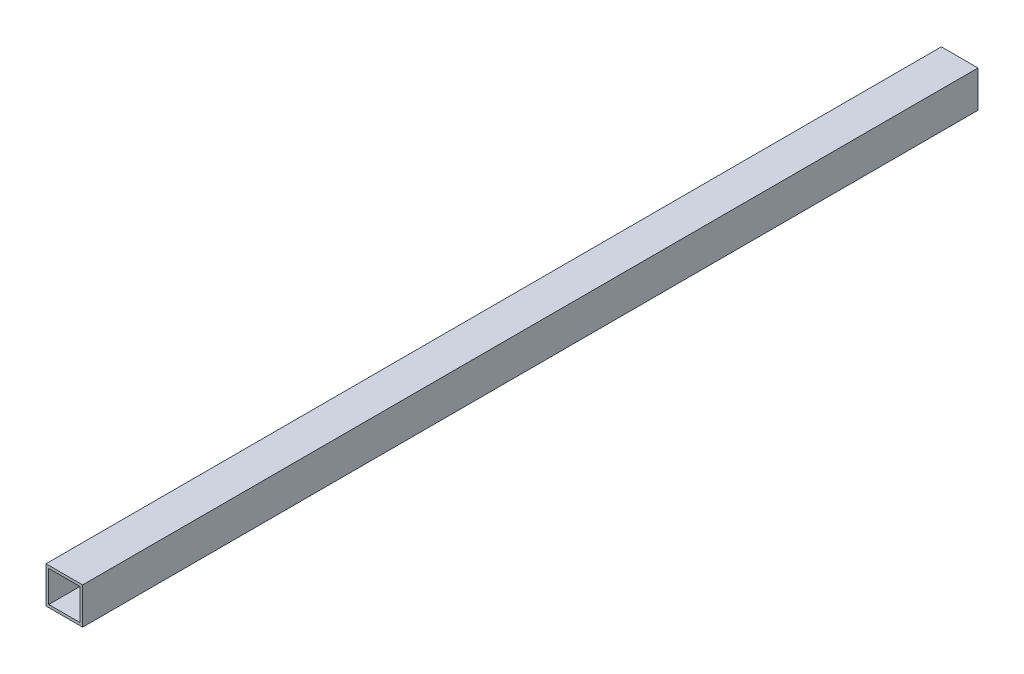
from build123d import *

# Parameters (mm, degrees)
SALIENTE_EXTRUIR1_START = -80
CROQUIS1_W              = 13.5
CROQUIS1_H              = 13.5
CROQUIS1_W_2            = 11.5
CROQUIS1_H_2            = 11.5
SALIENTE_EXTRUIR1_DEPTH = 330


with BuildPart() as part:
    # Croquis1 → Saliente-Extruir1 (new body)
    with BuildSketch(Plane.XY.offset(SALIENTE_EXTRUIR1_START)):
        with Locations((0, 10.75)):
            Rectangle(CROQUIS1_W, CROQUIS1_H)
        with Locations((0, 10.75)):
            Rectangle(CROQUIS1_W_2, CROQUIS1_H_2, mode=Mode.SUBTRACT)
    extrude(amount=SALIENTE_EXTRUIR1_DEPTH)


solid = part.part
